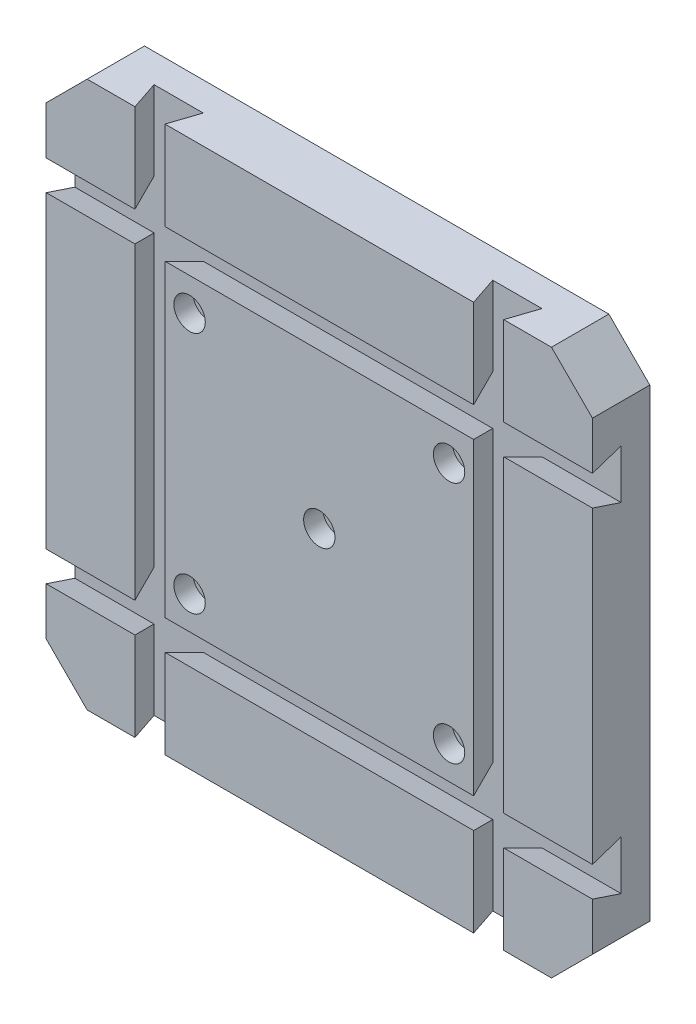
from build123d import *

# Parameters (mm, degrees)
SKETCH_1_W                      = 400
SKETCH_1_H                      = 400
EXTRUDE_1_DEPTH                 = 42
CHAMFER_1_SIZE                  = 30
CUT_EXTRUDE_1_DEPTH             = 450.181477802
PATTERN_CIRCULAR_1_COPY_1_DEPTH = 450.181477802
PATTERN_CIRCULAR_1_COPY_2_DEPTH = 450.181477802
HOLE_WIZARD_1_D                 = 13
HOLE_WIZARD_1_CBORE_D           = 23
HOLE_WIZARD_1_CBORE_DEPTH       = 14


with BuildPart() as part:
    # 草图1 → 凸台-拉伸1 (new body)
    with BuildSketch(Plane.XY):
        Rectangle(SKETCH_1_W, SKETCH_1_H)
    extrude(amount=EXTRUDE_1_DEPTH)

    # 倒角1
    chamfer_1_edges = [part.edges().sort_by_distance(p)[0] for p in [
        (-200, -200, 21),
        (-200, 200, 21),
        (200, 200, 21),
        (200, -200, 21),
    ]]
    chamfer(chamfer_1_edges, length=CHAMFER_1_SIZE)

    # 草图2 → 切除-拉伸1 (cut, symmetric)
    with BuildSketch(Plane.XZ.offset(200)):
        Polygon((-142, 21), (-106, 21), (-113, 42), (-135, 42), align=None)
    cut_extrude_1 = extrude(amount=CUT_EXTRUDE_1_DEPTH, both=True, mode=Mode.SUBTRACT)

    # 镜向1: 切除-拉伸1 across plane
    add(cut_extrude_1.mirror(Plane(origin=(0, 0, 0), x_dir=(0, 0, 1), z_dir=(1, 0, 0))), mode=Mode.SUBTRACT)

    # 阵列(圆周)1 copy 1 sketch → 阵列(圆周)1 copy 1 (cut, symmetric)
    with BuildSketch(Plane(origin=(200, 0, 0), x_dir=(0, -1, 0), z_dir=(1, 0, 0))):
        Polygon((-142, -21), (-106, -21), (-113, -42), (-135, -42), align=None)
    extrude(amount=PATTERN_CIRCULAR_1_COPY_1_DEPTH, both=True, mode=Mode.SUBTRACT)

    # 阵列(圆周)1 copy 2 sketch → 阵列(圆周)1 copy 2 (cut, symmetric)
    with BuildSketch(Plane.YZ.offset(200)):
        Polygon((-142, 21), (-106, 21), (-113, 42), (-135, 42), align=None)
    extrude(amount=PATTERN_CIRCULAR_1_COPY_2_DEPTH, both=True, mode=Mode.SUBTRACT)

    # 孔1 (through all)
    with Locations(Plane.XY.offset(42)):
        with Locations((0, 0), (95, 89), (95, -89), (-95, -89), (-95, 89)):
            CounterBoreHole(HOLE_WIZARD_1_D / 2, HOLE_WIZARD_1_CBORE_D / 2, HOLE_WIZARD_1_CBORE_DEPTH)


solid = part.part
